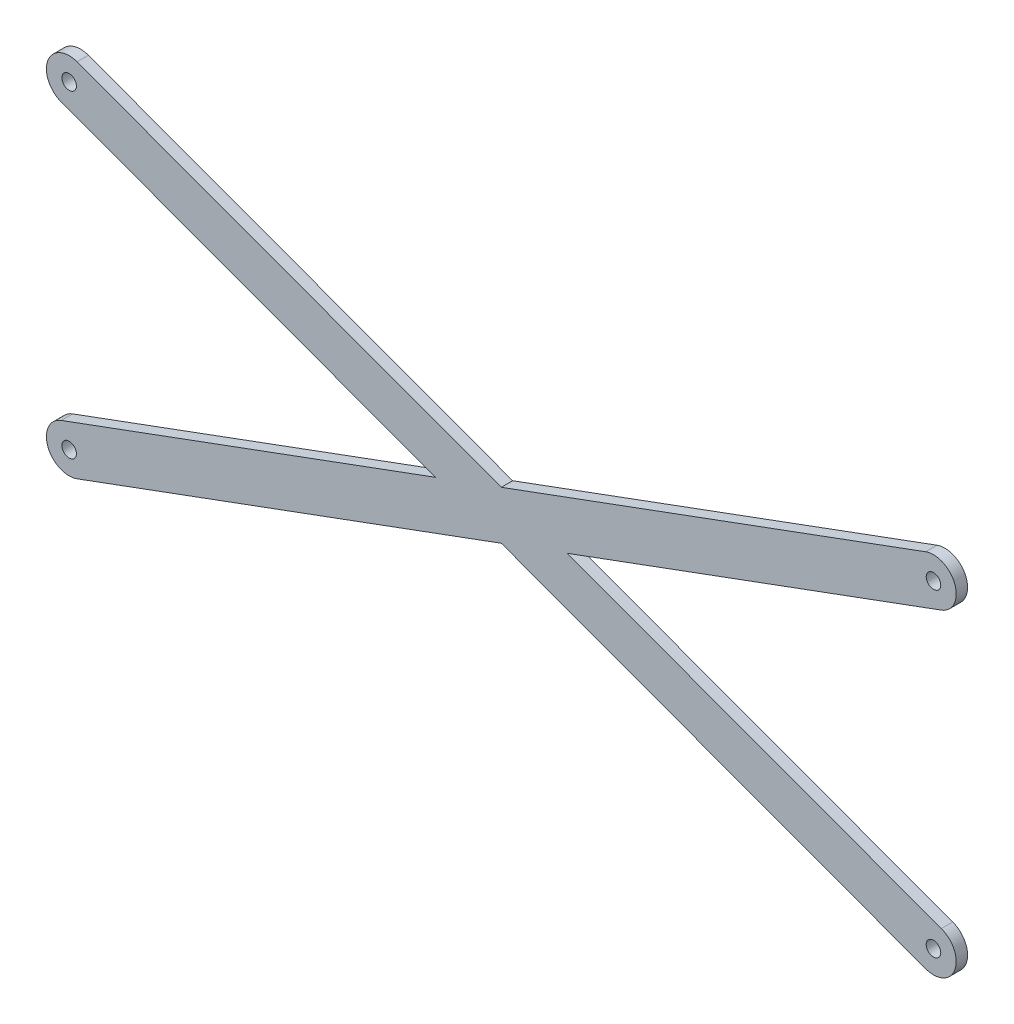
from build123d import *

# Parameters (mm, degrees)
BOSS_EXTRUDE1_DEPTH = 3.175
SKETCH2_R           = 2.032
CUT_EXTRUDE1_DEPTH  = 266.354791982


with BuildPart() as part:
    # Sketch1 → Boss-Extrude1 (new body)
    with BuildSketch(Plane.XY):
        with BuildLine():
            Line((-2.195226767, -82.94152037), (102.281759292, -44.45004426))
            Line((102.281759292, -44.45004426), (-2.195231212, -5.958477994))
            ThreePointArc((-2.195231212, -5.958477994), (-5.95843062, 2.195359776), (2.195488341, 5.958383249))
            Line((2.195488341, 5.958383249), (120.650005048, -37.682803747))
            Line((120.650005048, -37.682803747), (239.104554312, 5.958294883))
            ThreePointArc((239.104554312, 5.958294883), (247.258439301, 2.195232145), (243.495226767, -5.958583713))
            Line((243.495226767, -5.958583713), (139.018245757, -44.450057963))
            Line((139.018245757, -44.450057963), (243.494958814, -82.941522012))
            ThreePointArc((243.494958814, -82.941522012), (247.258209334, -91.095221053), (239.104516708, -94.858485472))
            Line((239.104516708, -94.858485472), (120.65, -51.217298476))
            Line((120.65, -51.217298476), (2.195450736, -94.858397105))
            ThreePointArc((2.195450736, -94.858397105), (-5.958438371, -91.095338753), (-2.195226767, -82.94152037))
        make_face()
    extrude(amount=BOSS_EXTRUDE1_DEPTH)

    # Sketch2 → Cut-Extrude1 (cut, through all)
    with BuildSketch(Plane.XY.offset(3.175)):
        Circle(SKETCH2_R)
        with Locations((0, -88.9)):
            Circle(SKETCH2_R)
        with Locations((241.299727604, -88.9)):
            Circle(SKETCH2_R)
        with Locations((241.3, -0.000104083)):
            Circle(SKETCH2_R)
    extrude(amount=-CUT_EXTRUDE1_DEPTH, mode=Mode.SUBTRACT)


solid = part.part
